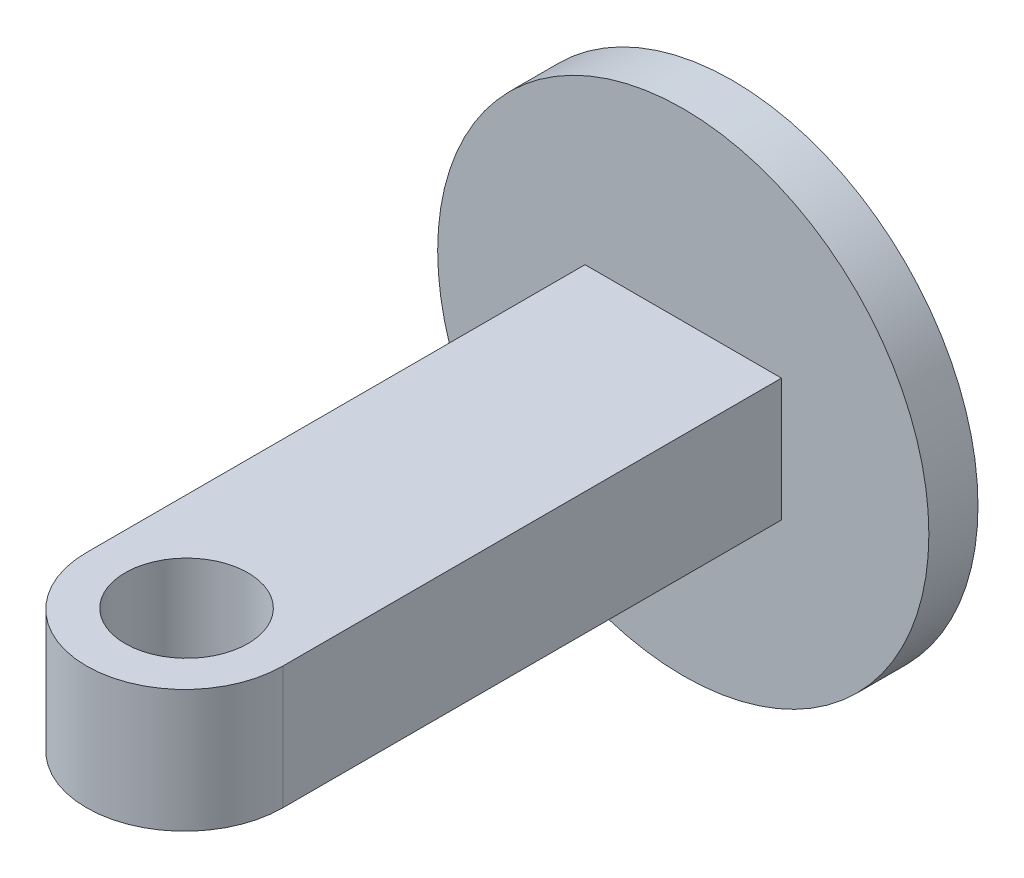
from build123d import *

# Parameters (mm, degrees)
SKETCH1_W           = 100
SKETCH1_H           = 20
BOSS_EXTRUDE4_START = 75
SKETCH6_R           = 25
BOSS_EXTRUDE4_DEPTH = 50


with BuildPart() as part:
    # Sketch1 → Revolve1 (revolve)
    with BuildSketch(Plane.YZ):
        with Locations((50, 10)):
            Rectangle(SKETCH1_W, SKETCH1_H)
    revolve(axis=Axis((0, 100, 0), (0, 0, 1)))

    # Sketch6 → Boss-Extrude4 (add)
    with BuildSketch(Plane(origin=(0, 0, 0), x_dir=(-1, 0, 0), z_dir=(0, 1, 0)).offset(BOSS_EXTRUDE4_START)):
        with BuildLine():
            Line((40, 20), (-40, 20))
            Line((-40, 20), (-40, 223))
            ThreePointArc((-40, 223), (0, 263), (40, 223))
            Line((40, 223), (40, 20))
        make_face()
        with Locations((0, 222.24)):
            Circle(SKETCH6_R, mode=Mode.SUBTRACT)
    extrude(amount=BOSS_EXTRUDE4_DEPTH)


solid = part.part
